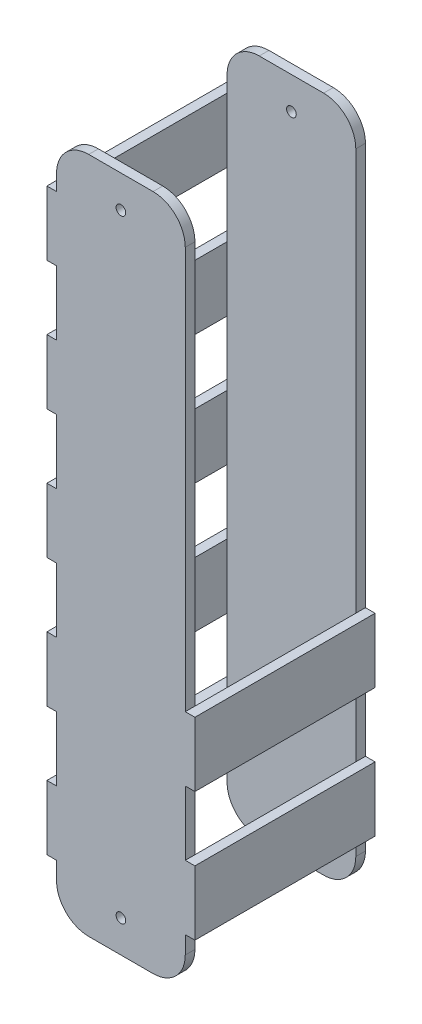
from build123d import *

# Parameters (mm, degrees)
BOSS_EXTRUDE1_START     = 50
BOSS_EXTRUDE1_DEPTH     = 3
BOSS_EXTRUDE2_DEPTH     = 3
CUT_EXTRUDE1_DEPTH      = 120.526409216
CUT_EXTRUDE1_DEPTH_BACK = 120.526409216
SKETCH2_R               = 1.5
SKETCH3_W               = 56
SKETCH3_H               = 20
BOSS_EXTRUDE4_DEPTH     = 3
SKETCH4_W               = 56
SKETCH4_H               = 20
BOSS_EXTRUDE5_DEPTH     = 3


with BuildPart() as part:
    # Sketch1 → Boss-Extrude1 (new body)
    with BuildSketch(Plane.XY.offset(BOSS_EXTRUDE1_START)):
        with BuildLine():
            Line((-10, 105.25), (10, 105.25))
            ThreePointArc((10, 105.25), (17.071067812, 102.321067812), (20, 95.25))
            Line((20, 95.25), (20, -95.25))
            ThreePointArc((20, -95.25), (17.071067812, -102.321067812), (10, -105.25))
            Line((10, -105.25), (-10, -105.25))
            ThreePointArc((-10, -105.25), (-17.071067812, -102.321067812), (-20, -95.25))
            Line((-20, -95.25), (-20, 95.25))
            ThreePointArc((-20, 95.25), (-17.071067812, 102.321067812), (-10, 105.25))
        make_face()
    extrude(amount=BOSS_EXTRUDE1_DEPTH)


with BuildPart() as body_2:
    # Sketch1<3> → Boss-Extrude2 (new body)
    with BuildSketch(Plane.XY):
        with BuildLine():
            Line((-10, 105.25), (10, 105.25))
            ThreePointArc((10, 105.25), (17.071067812, 102.321067812), (20, 95.25))
            Line((20, 95.25), (20, -95.25))
            ThreePointArc((20, -95.25), (17.071067812, -102.321067812), (10, -105.25))
            Line((10, -105.25), (-10, -105.25))
            ThreePointArc((-10, -105.25), (-17.071067812, -102.321067812), (-20, -95.25))
            Line((-20, -95.25), (-20, 95.25))
            ThreePointArc((-20, 95.25), (-17.071067812, 102.321067812), (-10, 105.25))
        make_face()
    extrude(amount=-BOSS_EXTRUDE2_DEPTH)


with BuildPart() as cut_extrude1_tool:
    # Sketch2 → Cut-Extrude1 (new, two sides: drawn at the far end of the back side and taken through both)
    with BuildSketch(Plane.XY.offset(-CUT_EXTRUDE1_DEPTH_BACK)):
        with Locations((0, 95.25)):
            Circle(SKETCH2_R)
        with Locations((0, -95.25)):
            Circle(SKETCH2_R)
    extrude(amount=CUT_EXTRUDE1_DEPTH + CUT_EXTRUDE1_DEPTH_BACK)


with BuildPart() as part_1:
    add(part.part)

    # Cut-Extrude1: cut by cut_extrude1_tool
    add(cut_extrude1_tool.part, mode=Mode.SUBTRACT)



with BuildPart() as body_2_1:
    add(body_2.part)

    # Cut-Extrude1: cut by cut_extrude1_tool
    add(cut_extrude1_tool.part, mode=Mode.SUBTRACT)


with BuildPart() as part_2:
    add(part_1.part)

    add(body_2_1.part)  # Boss-Extrude4 merges body 2
    # Sketch3 → Boss-Extrude4 (add)
    with BuildSketch(Plane.ZY.offset(20)):
        with Locations((25, 80.25)):
            Rectangle(SKETCH3_W, SKETCH3_H)
        with Locations((25, 40.25)):
            Rectangle(SKETCH3_W, SKETCH3_H)
        with Locations((25, 0.25)):
            Rectangle(SKETCH3_W, SKETCH3_H)
        with Locations((25, -39.75)):
            Rectangle(SKETCH3_W, SKETCH3_H)
        with Locations((25, -79.75)):
            Rectangle(SKETCH3_W, SKETCH3_H)
    extrude(amount=BOSS_EXTRUDE4_DEPTH)

    # Sketch4 → Boss-Extrude5 (add)
    with BuildSketch(Plane(origin=(20, 0, 0), x_dir=(0, 0, -1), z_dir=(1, 0, 0))):
        with Locations((-25, -79.75)):
            Rectangle(SKETCH4_W, SKETCH4_H)
        with Locations((-25, -39.75)):
            Rectangle(SKETCH4_W, SKETCH4_H)
    extrude(amount=BOSS_EXTRUDE5_DEPTH)


solid = part_2.part
